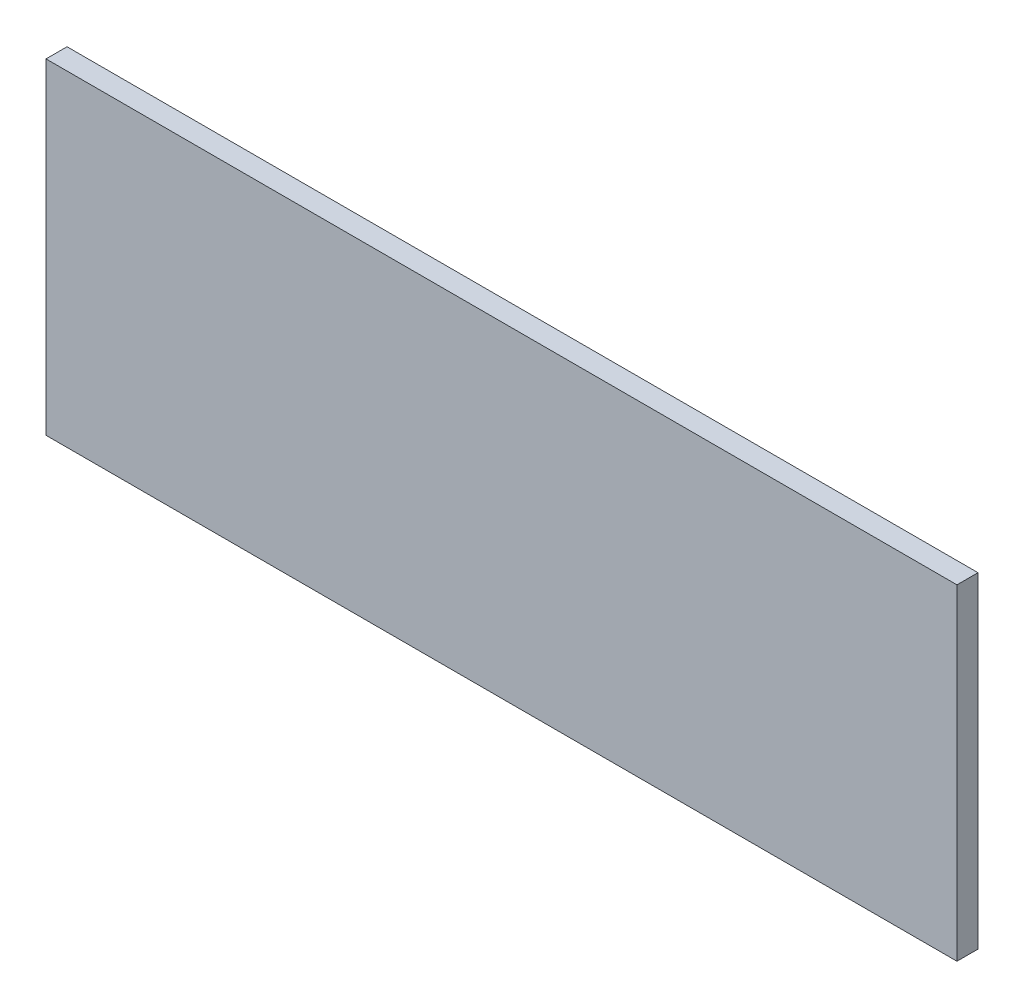
from build123d import *

# Parameters (mm, degrees)
SKETCH_1_W      = 693
SKETCH_1_H      = 248
EXTRUDE_1_DEPTH = 16


with BuildPart() as part:
    # 草图1 → 凸台-拉伸1 (new body)
    with BuildSketch(Plane.XY):
        Rectangle(SKETCH_1_W, SKETCH_1_H)
    extrude(amount=EXTRUDE_1_DEPTH)


solid = part.part
